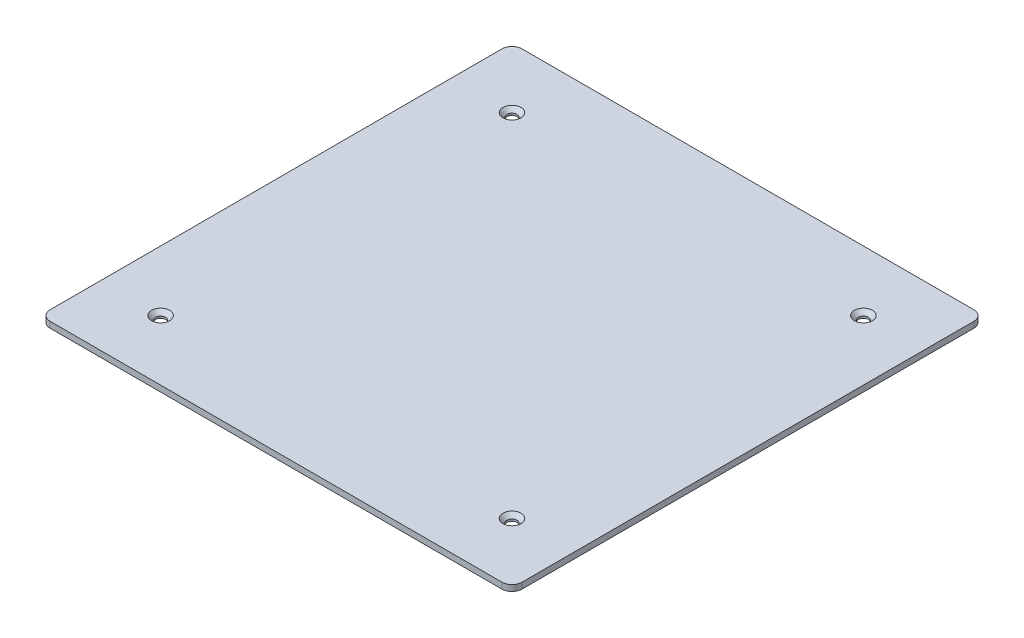
from build123d import *

# Parameters (mm, degrees)
ESQUISSE1_R        = 2.5
BOSS_EXTRU_1_DEPTH = 3
CHANFREIN1_SIZE    = 2


with BuildPart() as part:
    # Esquisse1 → Boss.-Extru.1 (new body)
    with BuildSketch(Plane(origin=(0, 0, 0), x_dir=(1, 0, 0), z_dir=(0, 1, 0))):
        with BuildLine():
            Line((112.5, -117.5), (-112.5, -117.5))
            ThreePointArc((-112.5, -117.5), (-116.035533906, -116.035533906), (-117.5, -112.5))
            Line((-117.5, -112.5), (-117.5, 112.5))
            ThreePointArc((-117.5, 112.5), (-116.035533906, 116.035533906), (-112.5, 117.5))
            Line((-112.5, 117.5), (112.5, 117.5))
            ThreePointArc((112.5, 117.5), (116.035533906, 116.035533906), (117.5, 112.5))
            Line((117.5, 112.5), (117.5, -112.5))
            ThreePointArc((117.5, -112.5), (116.035533906, -116.035533906), (112.5, -117.5))
        make_face()
        with Locations(Location((-87.5, 87.5, 0), (0, 0, 270))):
            Circle(ESQUISSE1_R, mode=Mode.SUBTRACT)
        with Locations(Location((-87.5, -87.5, 0), (0, 0, 270))):
            Circle(ESQUISSE1_R, mode=Mode.SUBTRACT)
        with Locations(Location((87.5, -87.5, 0), (0, 0, 270))):
            Circle(ESQUISSE1_R, mode=Mode.SUBTRACT)
        with Locations(Location((87.5, 87.5, 0), (0, 0, 270))):
            Circle(ESQUISSE1_R, mode=Mode.SUBTRACT)
    extrude(amount=BOSS_EXTRU_1_DEPTH)

    # Chanfrein1
    chanfrein1_edges = [part.edges().sort_by_distance(p)[0] for p in [
        (-87.5, 3, -90),
        (-87.5, 3, 85),
        (87.5, 3, 85),
        (87.5, 3, -90),
    ]]
    chamfer(chanfrein1_edges, length=CHANFREIN1_SIZE)


solid = part.part
